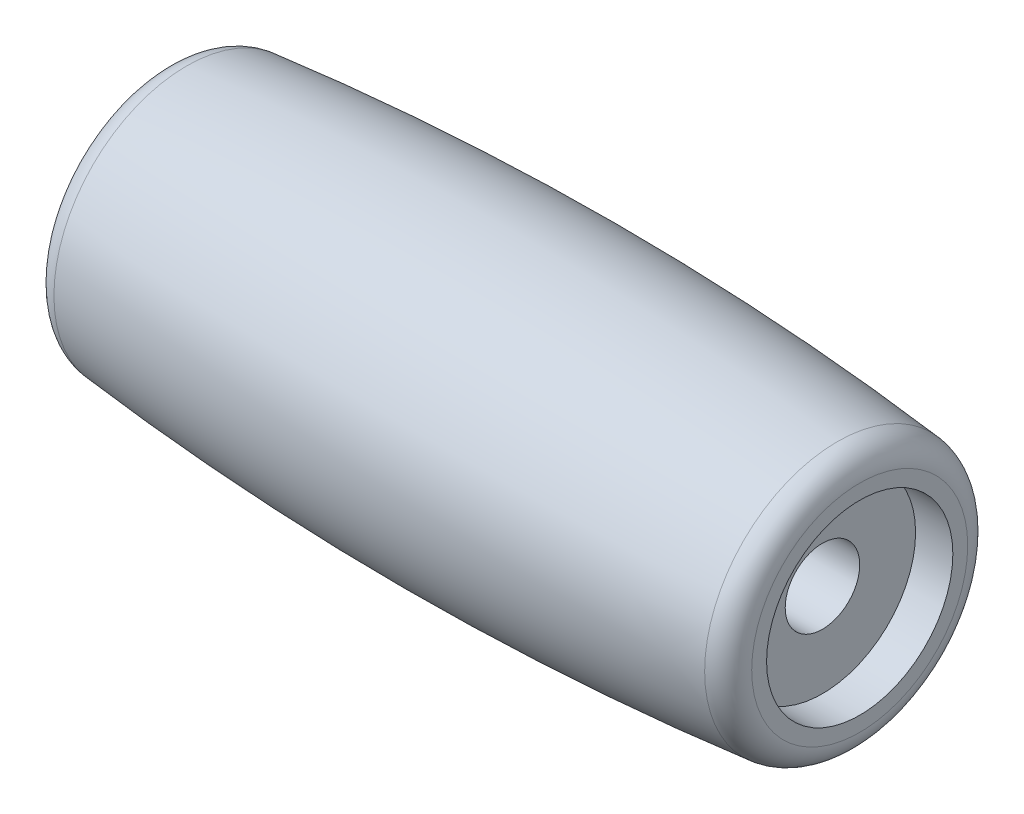
from build123d import *


with BuildPart() as part:
    # Esquisse1 → Révolution1 (revolve)
    with BuildSketch(Plane.XY, mode=Mode.PRIVATE) as r_volution1_sk:
        with BuildLine():
            Line((-12.5, 1.5), (12.5, 1.5))
            Line((12.5, 1.5), (12.5, 3.75))
            Line((12.5, 3.75), (14, 3.75))
            Line((14, 3.75), (14, 4.348576665))
            ThreePointArc((14, 4.348576665), (13.741609048, 5.019408999), (13.099967959, 5.343567322))
            ThreePointArc((13.099967959, 5.343567322), (0, 6), (-13.099967959, 5.343567322))
            ThreePointArc((-13.099967959, 5.343567322), (-13.741609048, 5.019408999), (-14, 4.348576665))
            Line((-14, 4.348576665), (-14, 3.75))
            Line((-14, 3.75), (-12.5, 3.75))
            Line((-12.5, 3.75), (-12.5, 1.5))
        make_face()
    revolve(r_volution1_sk.sketch.rotate(Axis((0, 0, 0), (1, 0, 0)), 90), axis=Axis((0, 0, 0), (1, 0, 0)))


solid = part.part
